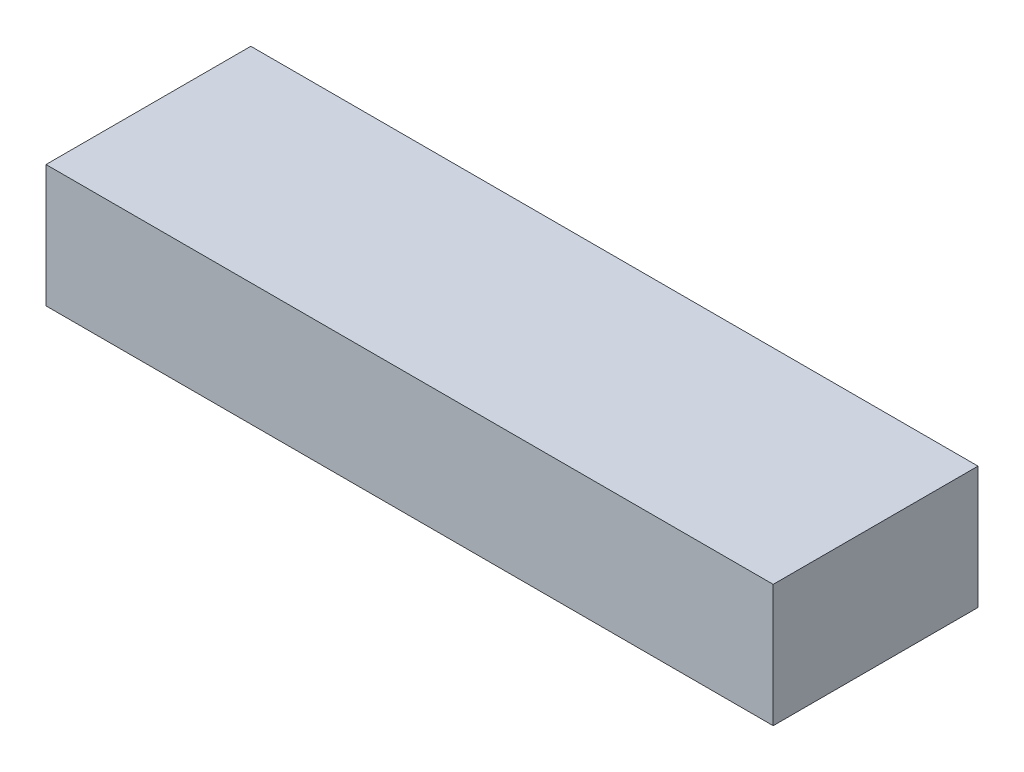
from build123d import *

# Parameters (mm, degrees)
SKETCH1_W           = 59.389249839
SKETCH1_H           = 16.727110877
BOSS_EXTRUDE1_DEPTH = 10


with BuildPart() as part:
    # Sketch1 → Boss-Extrude1 (new body)
    with BuildSketch(Plane(origin=(0, 0, 0), x_dir=(1, 0, 0), z_dir=(0, 1, 0))):
        with Locations((-33.296056583, 29.886397045)):
            Rectangle(SKETCH1_W, SKETCH1_H)
    extrude(amount=BOSS_EXTRUDE1_DEPTH)


solid = part.part
